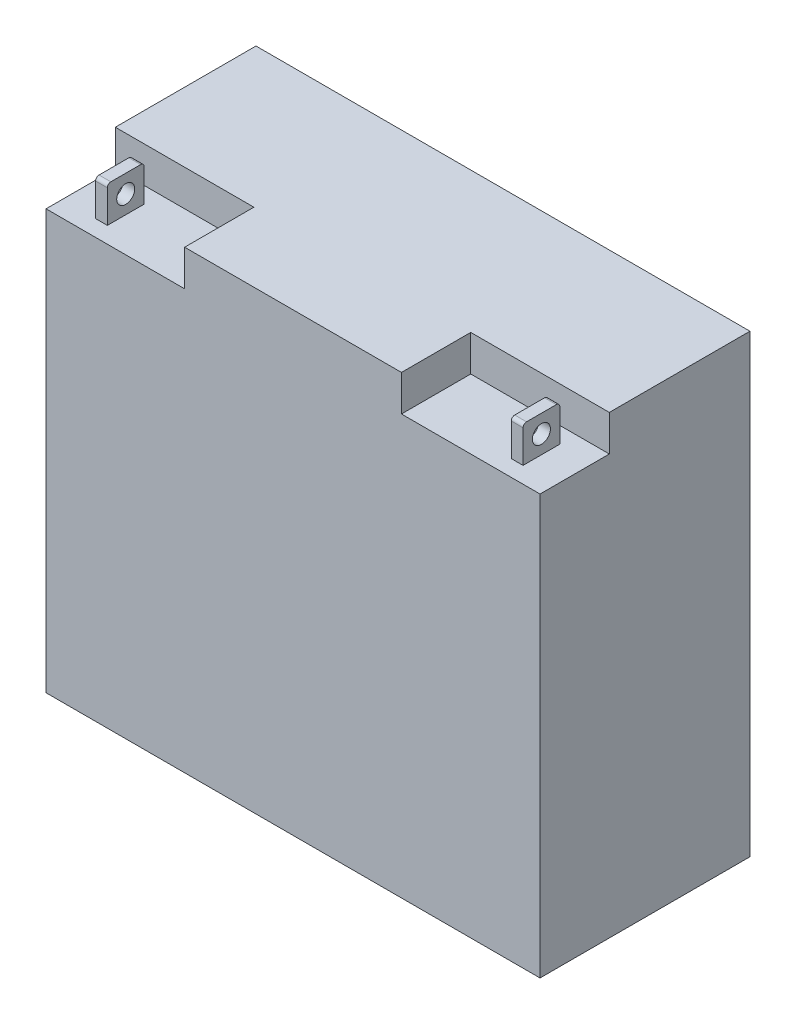
from build123d import *

# Parameters (mm, degrees)
SKETCH2_W           = 181.102
SKETCH2_H           = 76.962
BOSS_EXTRUDE1_DEPTH = 166.878
CUT_EXTRUDE1_DEPTH  = 194.722837699
SKETCH4_3_W         = 50.8
SKETCH4_3_H         = 25.4
CUT_EXTRUDE2_DEPTH  = 13.208
SKETCH5_W           = 4.318
SKETCH5_H           = 13.462
BOSS_EXTRUDE2_DEPTH = 13.208
SKETCH6_R           = 3.302
CUT_EXTRUDE3_DEPTH  = 13.208
FILLET1_R           = 1.27


with BuildPart() as part:
    # Sketch2 → Boss-Extrude1 (new body)
    with BuildSketch(Plane(origin=(0, 0, 0), x_dir=(1, 0, 0), z_dir=(0, 1, 0))):
        Rectangle(SKETCH2_W, SKETCH2_H)
    extrude(amount=BOSS_EXTRUDE1_DEPTH)

    # Sketch4 → Cut-Extrude1 (cut, through all)
    with BuildSketch(Plane(origin=(0, 166.878, 0), x_dir=(1, 0, 0), z_dir=(0, 1, 0))):
        Polygon((0, -38.481), (0, 0), (0, 38.481), (-90.551, 38.481), (-90.551, -38.481), align=None)
    extrude(amount=-CUT_EXTRUDE1_DEPTH, mode=Mode.SUBTRACT)

    # Sketch4<3> → Cut-Extrude2 (cut)
    with BuildSketch(Plane(origin=(0, 166.878, 0), x_dir=(1, 0, 0), z_dir=(0, 1, 0))):
        with Locations((65.151, -25.781)):
            Rectangle(SKETCH4_3_W, SKETCH4_3_H)
    extrude(amount=-CUT_EXTRUDE2_DEPTH, mode=Mode.SUBTRACT)

    # Sketch5 → Boss-Extrude2 (add)
    with BuildSketch(Plane(origin=(0, 153.67, 0), x_dir=(1, 0, 0), z_dir=(0, 1, 0))):
        with Locations((76.2, -25.781)):
            Rectangle(SKETCH5_W, SKETCH5_H)
    extrude(amount=BOSS_EXTRUDE2_DEPTH)

    # Sketch6 → Cut-Extrude3 (cut)
    with BuildSketch(Plane(origin=(78.359, 0, 0), x_dir=(0, 0, -1), z_dir=(1, 0, 0))):
        with Locations((-25.781, 160.274)):
            Circle(SKETCH6_R)
    extrude(amount=-CUT_EXTRUDE3_DEPTH, mode=Mode.SUBTRACT)

    # Fillet1
    fillet1_edges = [part.edges().sort_by_distance(p)[0] for p in [
        (76.2, 166.878, 19.05),
        (76.2, 166.878, 32.512),
    ]]
    fillet(fillet1_edges, radius=FILLET1_R)

    # Mirror1: part across plane


with BuildPart() as part_1:
    add(part.part)
    add(part.part.mirror(Plane.ZY))


solid = part_1.part
